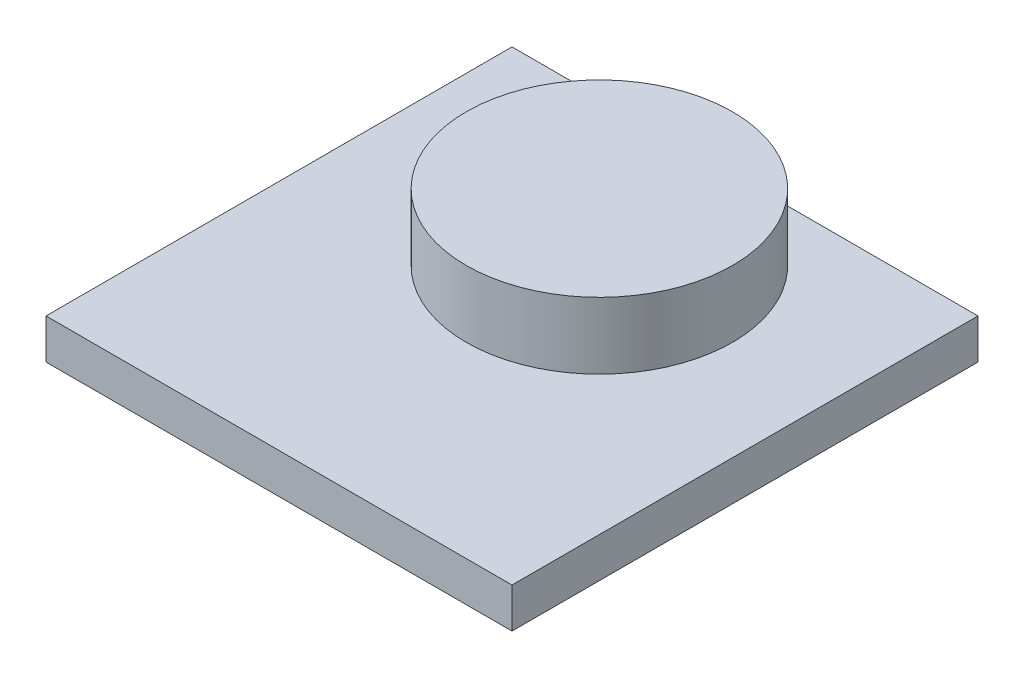
from build123d import *

# Parameters (mm, degrees)
SKETCH1_W           = 35
SKETCH1_H           = 35
BOSS_EXTRUDE1_DEPTH = 3
SKETCH2_R           = 10
BOSS_EXTRUDE2_DEPTH = 5


with BuildPart() as part:
    # Sketch1 → Boss-Extrude1 (new body)
    with BuildSketch(Plane(origin=(0, 0, 0), x_dir=(1, 0, 0), z_dir=(0, 1, 0))):
        with Locations((17.5, -17.5)):
            Rectangle(SKETCH1_W, SKETCH1_H)
    extrude(amount=-BOSS_EXTRUDE1_DEPTH)

    # Sketch2 → Boss-Extrude2 (add)
    with BuildSketch(Plane(origin=(0, 0, 0), x_dir=(1, 0, 0), z_dir=(0, 1, 0))):
        with Locations(Location((17.5, -10.9375, 0), (0, 0, 270))):
            Circle(SKETCH2_R)
    extrude(amount=BOSS_EXTRUDE2_DEPTH)


solid = part.part
